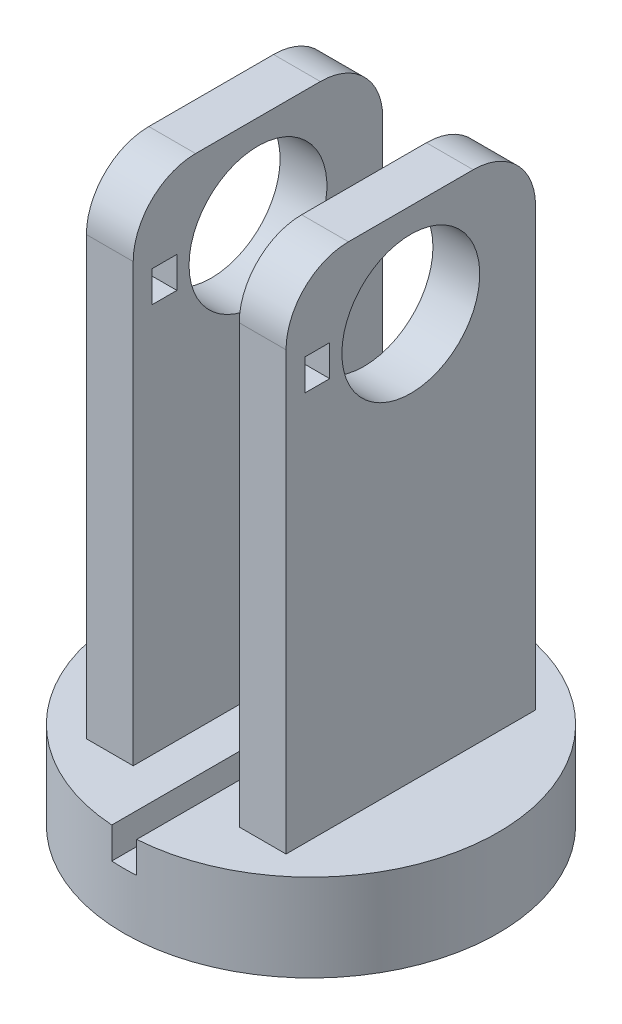
from build123d import *

# Parameters (mm, degrees)
SKETCH1_R               = 30
BOSS_EXTRUDE1_DEPTH     = 14
SKETCH2_R               = 11.05
CUT_EXTRUDE1_DEPTH      = 7
SKETCH5_W               = 7.5
SKETCH5_H               = 40
BOSS_EXTRUDE2_DEPTH     = 80
FILLET1_R               = 10
CUT_EXTRUDE3_DEPTH      = 109.866891202
CUT_EXTRUDE3_DEPTH_BACK = 109.866891202
SKETCH7_R               = 11.05
CUT_EXTRUDE4_START      = -5
CUT_EXTRUDE4_DEPTH      = 5
CUT_EXTRUDE5_REACH      = 110.867
SKETCH9_W               = 4
SKETCH9_H               = 5


with BuildPart() as part:
    # Sketch1 → Boss-Extrude1 (new body)
    with BuildSketch(Plane(origin=(0, 0, 0), x_dir=(1, 0, 0), z_dir=(0, 1, 0))):
        with Locations(Location((0, 0, 0), (0, 0, 90))):
            Circle(SKETCH1_R)
    extrude(amount=BOSS_EXTRUDE1_DEPTH)

    # Sketch2 → Cut-Extrude1 (cut)
    with BuildSketch(Plane.XZ):
        with Locations(Location((0, 0, 0), (0, 0, 270))):
            Circle(SKETCH2_R)
    extrude(amount=-CUT_EXTRUDE1_DEPTH, mode=Mode.SUBTRACT)

    # Sketch5 → Boss-Extrude2 (add)
    with BuildSketch(Plane(origin=(0, 14, 0), x_dir=(1, 0, 0), z_dir=(0, 1, 0))):
        with Locations((-12.25, 0)):
            Rectangle(SKETCH5_W, SKETCH5_H)
        with Locations((12.25, 0)):
            Rectangle(SKETCH5_W, SKETCH5_H)
    extrude(amount=BOSS_EXTRUDE2_DEPTH)

    # Fillet1
    fillet1_edges = [part.edges().sort_by_distance(p)[0] for p in [
        (-12.25, 94, 20),
        (-12.25, 94, -20),
        (12.25, 94, 20),
        (12.25, 94, -20),
    ]]
    fillet(fillet1_edges, radius=FILLET1_R)

    # Sketch7 → Cut-Extrude3 (cut, two sides: drawn at the far end of the back side and taken through both)
    with BuildSketch(Plane.ZY.offset(16).offset(-CUT_EXTRUDE3_DEPTH_BACK)):
        with Locations((0, 79)):
            Circle(SKETCH7_R)
    extrude(amount=CUT_EXTRUDE3_DEPTH + CUT_EXTRUDE3_DEPTH_BACK, mode=Mode.SUBTRACT)

    # Sketch8 → Cut-Extrude4 (cut)
    with BuildSketch(Plane(origin=(0, 14, 0), x_dir=(1, 0, 0), z_dir=(0, 1, 0)).offset(CUT_EXTRUDE4_START)):
        with BuildLine():
            Line((2, 29.933259094), (2, -29.933259094))
            ThreePointArc((2, -29.933259094), (0, -30), (-2, -29.933259094))
            Line((-2, -29.933259094), (-2, 29.933259094))
            ThreePointArc((-2, 29.933259094), (0, 30), (2, 29.933259094))
        make_face()
    extrude(amount=CUT_EXTRUDE4_DEPTH, mode=Mode.SUBTRACT)

    # Cut-Extrude5: up to this face of the body (flat: up to its plane)
    cut_extrude5_end = Plane(part.part.faces().sort_by_distance((16, 49.957843981, 0))[0])
    # Sketch9 → Cut-Extrude5 (cut, up to the picked face)
    with BuildSketch(Plane.ZY.offset(16), mode=Mode.PRIVATE) as cut_extrude5_sk1:
        with Locations((15, 79)):
            Rectangle(SKETCH9_W, SKETCH9_H)
    cut_extrude5_tool1 = split(extrude(cut_extrude5_sk1.sketch, amount=-CUT_EXTRUDE5_REACH, mode=Mode.PRIVATE), bisect_by=cut_extrude5_end, keep=Keep.BOTH, mode=Mode.PRIVATE)
    add(cut_extrude5_tool1.solids().sort_by(Axis((-16, 79, 15), (1, 0, 0)))[0], mode=Mode.SUBTRACT)


solid = part.part
